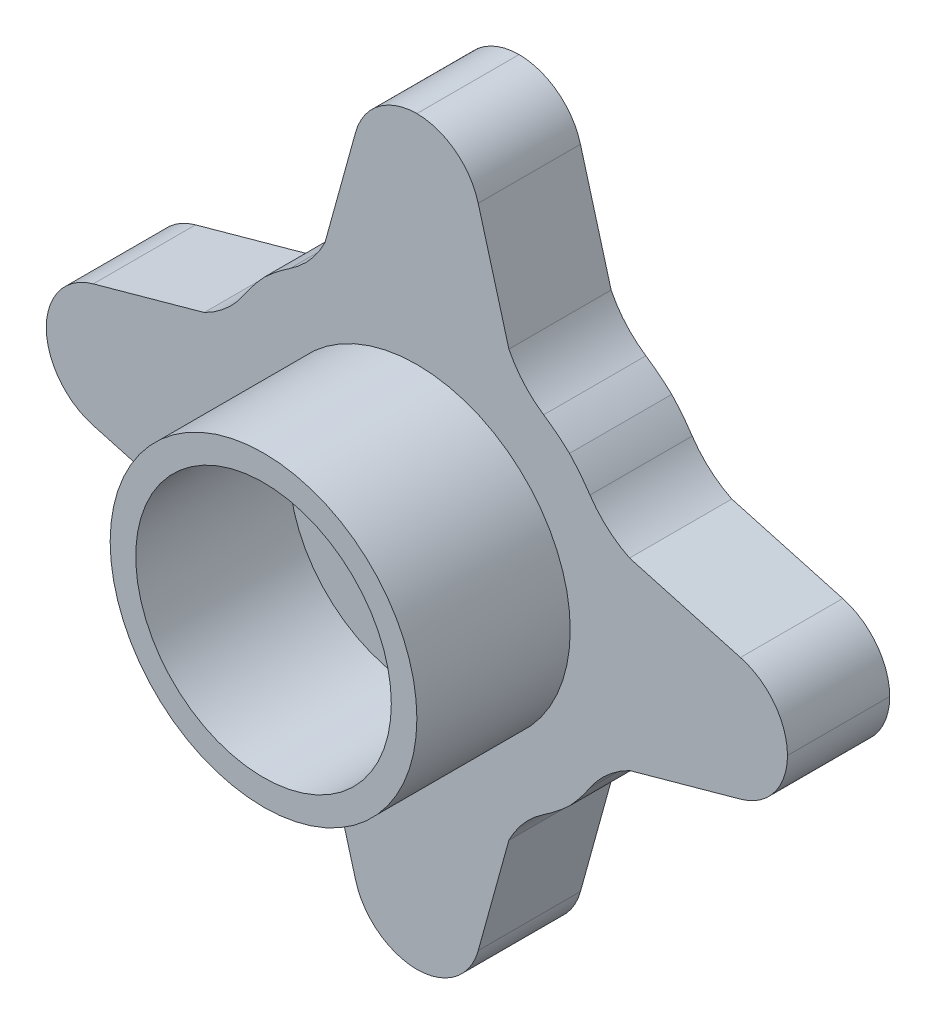
from build123d import *

# Parameters (mm, degrees)
BOSS_EXTRUDE1_DEPTH = 2
SKETCH2_R           = 3
SKETCH2_R_2         = 2.5
BOSS_EXTRUDE2_DEPTH = 3
SKETCH3_R           = 1
CUT_EXTRUDE1_DEPTH  = 1
SKETCH4_R           = 0.5
CUT_EXTRUDE2_DEPTH  = 12.407234547


with BuildPart() as part:
    # Sketch1 → Boss-Extrude1 (new body)
    with BuildSketch(Plane.XY):
        with BuildLine():
            Line((-1.2, 6.33), (-1.8, 4.16))
            ThreePointArc((-1.8, 4.16), (-2.089343599, 3.728660349), (-2.48, 3.386372183))
            ThreePointArc((-2.48, 3.386372183), (-2.740944688, 3.196252087), (-2.985706385, 2.985706385))
            ThreePointArc((-2.985706385, 2.985706385), (-3.196252087, 2.740944688), (-3.386372183, 2.48))
            ThreePointArc((-3.386372183, 2.48), (-3.728660349, 2.089343599), (-4.16, 1.8))
            Line((-4.16, 1.8), (-6.33, 1.2))
            ThreePointArc((-6.33, 1.2), (-6.992020752, 0.754882576), (-7.25, 0))
            ThreePointArc((-7.25, 0), (-6.992020752, -0.754882576), (-6.33, -1.2))
            Line((-6.33, -1.2), (-4.16, -1.8))
            ThreePointArc((-4.16, -1.8), (-3.728660349, -2.089343599), (-3.386372183, -2.48))
            ThreePointArc((-3.386372183, -2.48), (-3.196252087, -2.740944688), (-2.985706385, -2.985706385))
            ThreePointArc((-2.985706385, -2.985706385), (-2.740944688, -3.196252087), (-2.48, -3.386372183))
            ThreePointArc((-2.48, -3.386372183), (-2.089343599, -3.728660349), (-1.8, -4.16))
            Line((-1.8, -4.16), (-1.2, -6.33))
            ThreePointArc((-1.2, -6.33), (-0.754882576, -6.992020752), (0, -7.25))
            ThreePointArc((0, -7.25), (0.754882576, -6.992020752), (1.2, -6.33))
            Line((1.2, -6.33), (1.8, -4.16))
            ThreePointArc((1.8, -4.16), (2.089343599, -3.728660349), (2.48, -3.386372183))
            ThreePointArc((2.48, -3.386372183), (2.740944688, -3.196252087), (2.985706385, -2.985706385))
            ThreePointArc((2.985706385, -2.985706385), (3.196252087, -2.740944688), (3.386372183, -2.48))
            ThreePointArc((3.386372183, -2.48), (3.728660349, -2.089343599), (4.16, -1.8))
            Line((4.16, -1.8), (6.33, -1.2))
            ThreePointArc((6.33, -1.2), (6.992020752, -0.754882576), (7.25, 0))
            ThreePointArc((7.25, 0), (6.992020752, 0.754882576), (6.33, 1.2))
            Line((6.33, 1.2), (4.16, 1.8))
            ThreePointArc((4.16, 1.8), (3.728660349, 2.089343599), (3.386372183, 2.48))
            ThreePointArc((3.386372183, 2.48), (3.196252087, 2.740944688), (2.985706385, 2.985706385))
            ThreePointArc((2.985706385, 2.985706385), (2.740944688, 3.196252087), (2.48, 3.386372183))
            ThreePointArc((2.48, 3.386372183), (2.089343599, 3.728660349), (1.8, 4.16))
            Line((1.8, 4.16), (1.2, 6.33))
            ThreePointArc((1.2, 6.33), (0.754882576, 6.992020752), (0, 7.25))
            ThreePointArc((0, 7.25), (-0.754882576, 6.992020752), (-1.2, 6.33))
        make_face()
    extrude(amount=BOSS_EXTRUDE1_DEPTH)

    # Sketch2 → Boss-Extrude2 (add)
    with BuildSketch(Plane.XY.offset(2)):
        with Locations(Location((0, 0, 0), (0, 0, 180))):
            Circle(SKETCH2_R)
        Circle(SKETCH2_R_2, mode=Mode.SUBTRACT)
    extrude(amount=BOSS_EXTRUDE2_DEPTH)

    # Sketch3 → Cut-Extrude1 (cut)
    with BuildSketch(Plane(origin=(0, 0, 0), x_dir=(-1, 0, 0), z_dir=(0, 0, -1))):
        Circle(SKETCH3_R)
    extrude(amount=-CUT_EXTRUDE1_DEPTH, mode=Mode.SUBTRACT)

    # Sketch4 → Cut-Extrude2 (cut, through all)
    with BuildSketch(Plane.XY):
        with Locations(Location((0, 0, 0), (0, 0, 180))):
            Circle(SKETCH4_R)
    extrude(amount=CUT_EXTRUDE2_DEPTH, mode=Mode.SUBTRACT)


solid = part.part
